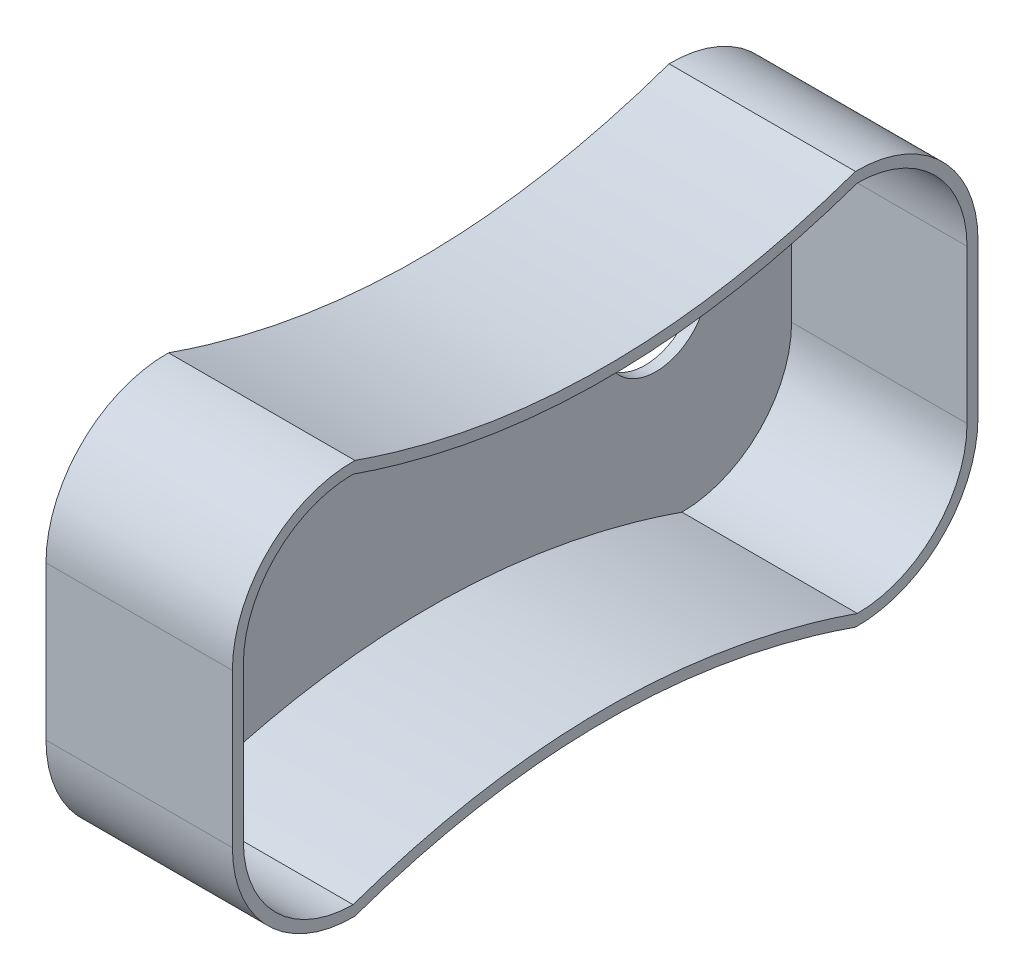
from build123d import *

# Parameters (mm, degrees)
CROQUIS1_R              = 23.6
SALIENTE_EXTRUIR1_DEPTH = 80
VACIADO1_T              = 5
CORTAR_EXTRUIR1_START   = -214
CROQUIS2_R              = 23.6
CORTAR_EXTRUIR1_DEPTH   = 214


with BuildPart() as part:
    # Croquis1 → Saliente-Extruir1 (new body)
    with BuildSketch(Plane(origin=(0, 0, 0), x_dir=(0, 0, -1), z_dir=(1, 0, 0))):
        with BuildLine():
            Line((165, -35), (165, 35))
            ThreePointArc((165, 35), (150.355339059, 70.355339059), (115, 85))
            add(Edge.make_bspline(
                [(-115, 85), (0, 45), (115, 85)],
                knots=[0, 0, 0, 1, 1, 1], degree=2))
            ThreePointArc((-115, 85), (-150.355339059, 70.355339059), (-165, 35))
            Line((-165, 35), (-165, -35))
            ThreePointArc((-165, -35), (-150.355339059, -70.355339059), (-115, -85))
            add(Edge.make_bspline(
                [(-115, -85), (0, -45), (115, -85)],
                knots=[0, 0, 0, 1, 1, 1], degree=2))
            ThreePointArc((115, -85), (150.355339059, -70.355339059), (165, -35))
        make_face()
        with Locations((-100, 0)):
            Circle(CROQUIS1_R, mode=Mode.SUBTRACT)
        with Locations((103.1, 0)):
            Circle(CROQUIS1_R, mode=Mode.SUBTRACT)
    extrude(amount=SALIENTE_EXTRUIR1_DEPTH)

    # Vaciado1
    vaciado1_openings = [part.faces().sort_by_distance(p)[0] for p in [
        (80, 0, 0.122383932),
    ]]
    offset(amount=VACIADO1_T, openings=vaciado1_openings, kind=Kind.INTERSECTION)

    # Croquis2 → Cortar-Extruir1 (cut)
    with BuildSketch(Plane(origin=(80, 0, 0), x_dir=(0, 0, -1), z_dir=(1, 0, 0)).offset(CORTAR_EXTRUIR1_START)):
        with Locations((-100, 0)):
            Circle(CROQUIS2_R)
        with Locations((103.1, 0)):
            Circle(CROQUIS2_R)
    extrude(amount=CORTAR_EXTRUIR1_DEPTH, mode=Mode.SUBTRACT)


solid = part.part
